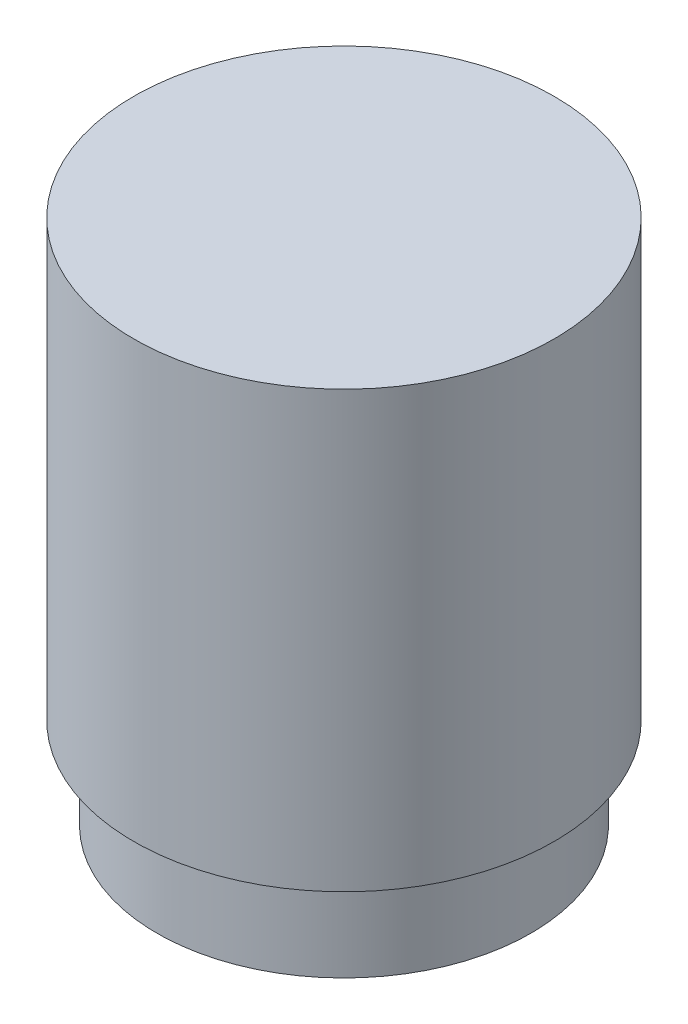
from build123d import *


with BuildPart() as part:
    # Sketch1 → Revolve1 (revolve)
    with BuildSketch(Plane(origin=(0, 0, 0), x_dir=(0, 0, -1), z_dir=(1, 0, 0)), mode=Mode.PRIVATE) as revolve1_sk:
        Polygon((-3, 4), (-4.75, 4), (-4.75, 0), (-5.65, 0), (-5.65, 2.75), (-6.35, 2.75), (-6.35, 15.9), (0, 15.9), (0, 13.46), (-3, 13.46), align=None)
    revolve(revolve1_sk.sketch.rotate(Axis((0, 0, 0), (0, 1, 0)), 180), axis=Axis((0, 0, 0), (0, 1, 0)))


solid = part.part
